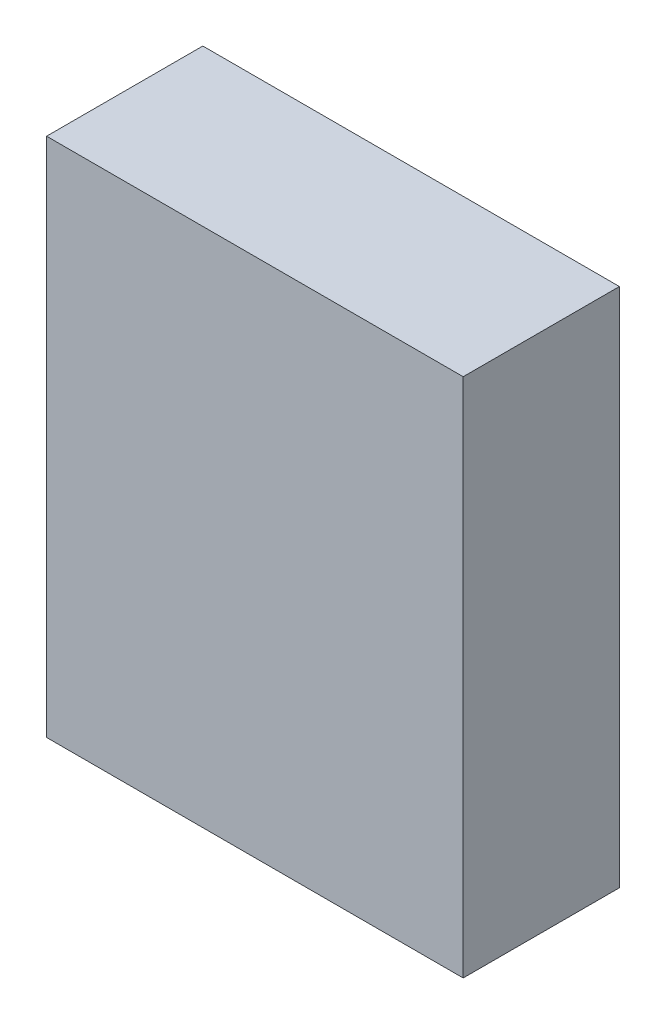
from build123d import *

# Parameters (mm, degrees)
SKETCH1_W           = 80
SKETCH1_H           = 100
BOSS_EXTRUDE1_DEPTH = 30


with BuildPart() as part:
    # Sketch1 → Boss-Extrude1 (new body)
    with BuildSketch(Plane.XY):
        with Locations((-35.636160714, -1.986607143)):
            Rectangle(SKETCH1_W, SKETCH1_H)
    extrude(amount=BOSS_EXTRUDE1_DEPTH)


solid = part.part
